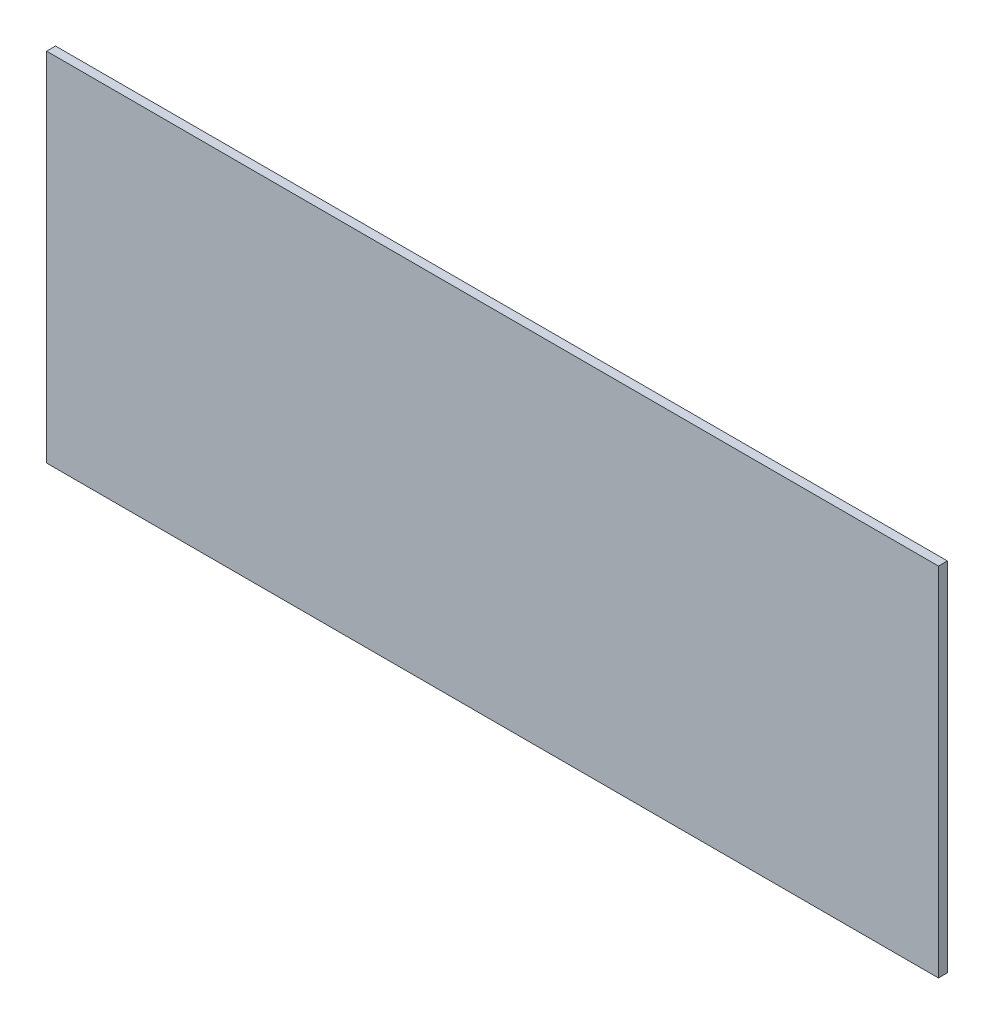
from build123d import *

# Parameters (mm, degrees)
SKETCH1_W           = 300
SKETCH1_H           = 120
BOSS_EXTRUDE1_DEPTH = 3


with BuildPart() as part:
    # Sketch1 → Boss-Extrude1 (new body)
    with BuildSketch(Plane.XY):
        with Locations((150, 60)):
            Rectangle(SKETCH1_W, SKETCH1_H)
    extrude(amount=BOSS_EXTRUDE1_DEPTH)


solid = part.part
